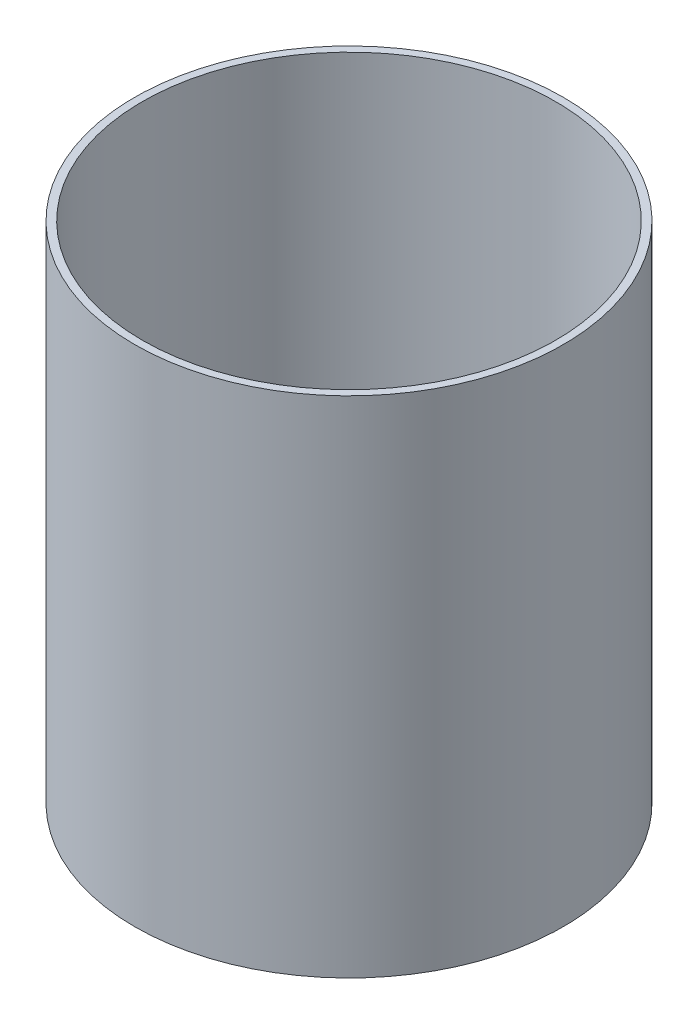
from build123d import *

# Parameters (mm, degrees)
SKETCH1_R           = 85
SKETCH1_R_2         = 82
BOSS_EXTRUDE1_DEPTH = 200


with BuildPart() as part:
    # Sketch1 → Boss-Extrude1 (new body)
    with BuildSketch(Plane(origin=(0, 0, 0), x_dir=(1, 0, 0), z_dir=(0, 1, 0))):
        with Locations(Location((0, 0, 0), (0, 0, 270))):
            Circle(SKETCH1_R)
        with Locations(Location((0, 0, 0), (0, 0, 270))):
            Circle(SKETCH1_R_2, mode=Mode.SUBTRACT)
    extrude(amount=BOSS_EXTRUDE1_DEPTH)


solid = part.part
